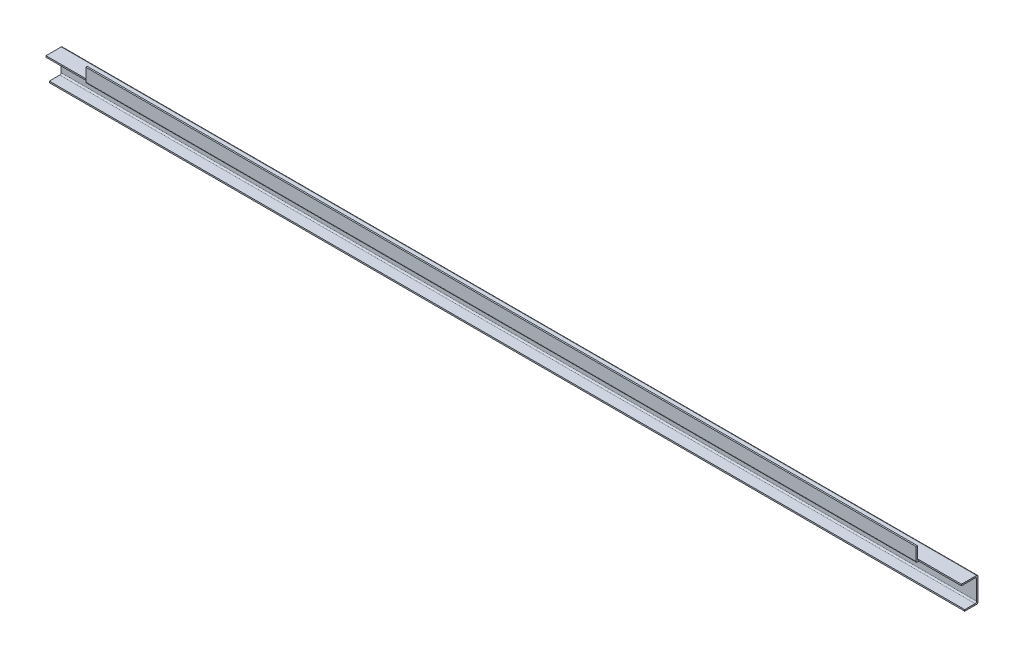
from build123d import *

# Parameters (mm, degrees)
BOSS_EXTRUDE1_DEPTH = 1934
FILLET1_R           = 3
SKETCH2_W           = 90
SKETCH2_H           = 30
CUT_EXTRUDE1_DEPTH  = 6
SKETCH3_W           = 90
SKETCH3_H           = 30
CUT_EXTRUDE2_DEPTH  = 6


with BuildPart() as part:
    # Sketch1 → Boss-Extrude1 (new body)
    with BuildSketch(Plane(origin=(0, 0, 0), x_dir=(0, 0, -1), z_dir=(1, 0, 0))):
        Polygon((0, 0), (25, 0), (25, 47), (-13, 47), (-13, 77), (-10, 77), (-10, 50), (28, 50), (28, -3), (0, -3), align=None)
    extrude(amount=BOSS_EXTRUDE1_DEPTH)

    # Fillet1
    fillet1_edges = [part.edges().sort_by_distance(p)[0] for p in [
        (967, 0, -25),
        (967, 47, -25),
        (967, 47, 13),
        (967, 50, 10),
        (967, 50, -28),
        (967, -3, -28),
    ]]
    fillet(fillet1_edges, radius=FILLET1_R)

    # Sketch2 → Cut-Extrude1 (cut)
    with BuildSketch(Plane.XY.offset(13)):
        with Locations((45, 62)):
            Rectangle(SKETCH2_W, SKETCH2_H)
    extrude(amount=-CUT_EXTRUDE1_DEPTH, mode=Mode.SUBTRACT)

    # Sketch3 → Cut-Extrude2 (cut)
    with BuildSketch(Plane.XY.offset(13)):
        with Locations((1889, 62)):
            Rectangle(SKETCH3_W, SKETCH3_H)
    extrude(amount=-CUT_EXTRUDE2_DEPTH, mode=Mode.SUBTRACT)


solid = part.part
